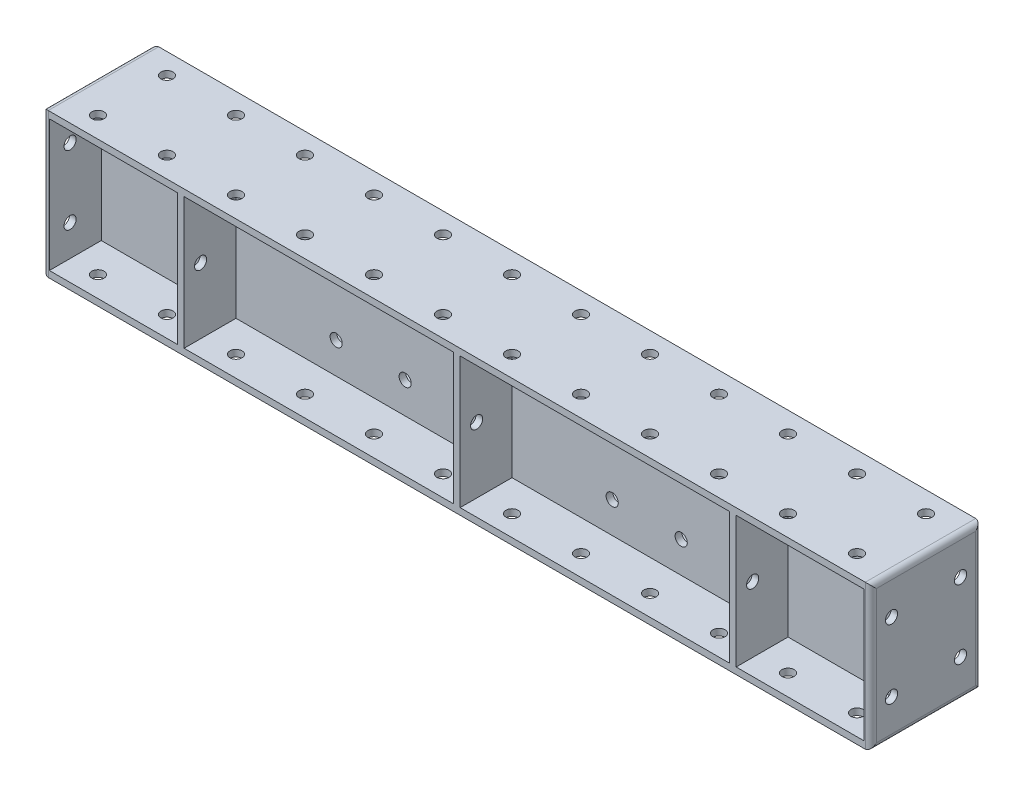
from build123d import *

# Parameters (mm, degrees)
SKETCH_1_W                        = 1500
SKETCH_1_H                        = 262
EXTRUDE_1_DEPTH                   = 200
SKETCH_5_W                        = 232
SKETCH_5_H                        = 238
SKETCH_5_W_2                      = 488
CUT_EXTRUDE_10_DEPTH              = 1536.787745751
SKETCH_7_W                        = 1500
SKETCH_7_H                        = 12
EXTRUDE_13_DEPTH                  = 260
SKETCH_8_R                        = 11
CUT_EXTRUDE_14_DEPTH              = 1536.787745751
PATTERN_LINEAR_3_COUNT            = 12
PATTERN_LINEAR_3_PITCH            = 125
PATTERN_LINEAR_3_COUNT_DIR2       = 2
PATTERN_LINEAR_3_PITCH_DIR2       = 125
SKETCH_10_R                       = 11
CUT_EXTRUDE_16_DEPTH              = 20
PATTERN_LINEAR_5_COUNT            = 2
PATTERN_LINEAR_5_PITCH            = 125
PATTERN_LINEAR_5_COUNT_DIR2       = 2
PATTERN_LINEAR_5_PITCH_DIR2       = 125
CUT_EXTRUDE_START                 = -20
SKETCH_11_R                       = 11
CUT_EXTRUDE_17_DEPTH              = 20
PATTERN_LINEAR_6_COUNT            = 2
PATTERN_LINEAR_6_PITCH            = 125
PATTERN_LINEAR_6_COUNT_DIR2       = 2
PATTERN_LINEAR_6_PITCH_DIR2       = 125
SKETCH_12_R                       = 11
CUT_EXTRUDE_18_DEPTH              = 1050
PATTERN_LINEAR_8_COUNT            = 2
PATTERN_LINEAR_8_PITCH            = 140.2426687
FILLET_1_R                        = 10
FILLET_2_R                        = 10
SKETCH_13_R                       = 11
CUT_EXTRUDE_19_DEPTH              = 1527.394444434
PATTERN_LINEAR_9_COUNT            = 2
PATTERN_LINEAR_9_PITCH            = 125
PATTERN_LINEAR_9_COUNT_DIR2       = 2
PATTERN_LINEAR_9_PITCH_DIR2       = 125
PATTERN_LINEAR_10_COUNT           = 2
PATTERN_LINEAR_10_PITCH           = 500
PATTERN_LINEAR_10_COPY_1_SKETCH_R = 11
PATTERN_LINEAR_10_COPY_1_DEPTH    = 1527.394444434
PATTERN_LINEAR_10_COPY_2_SKETCH_R = 11
PATTERN_LINEAR_10_COPY_2_DEPTH    = 1527.394444434
PATTERN_LINEAR_10_COPY_3_SKETCH_R = 11
PATTERN_LINEAR_10_COPY_3_DEPTH    = 1527.394444434


with BuildPart() as part:
    # 草图1 → 拉伸1 (new body)
    with BuildSketch(Plane.XY):
        with Locations((750, 131)):
            Rectangle(SKETCH_1_W, SKETCH_1_H)
    extrude(amount=EXTRUDE_1_DEPTH)

    # 草图5 → 拉伸10 (cut, through all)
    with BuildSketch(Plane.XY.offset(200)):
        with Locations((128, 131)):
            Rectangle(SKETCH_5_W, SKETCH_5_H)
        with Locations((500, 131)):
            Rectangle(SKETCH_5_W_2, SKETCH_5_H)
        with Locations((1000, 131)):
            Rectangle(SKETCH_5_W_2, SKETCH_5_H)
        with Locations((1372, 131)):
            Rectangle(SKETCH_5_W, SKETCH_5_H)
    extrude(amount=-CUT_EXTRUDE_10_DEPTH, mode=Mode.SUBTRACT)

    # 草图7 → 拉伸13 (add)
    with BuildSketch(Plane.XZ):
        with Locations((750, 100)):
            Rectangle(SKETCH_7_W, SKETCH_7_H)
    extrude(amount=-EXTRUDE_13_DEPTH)

    # 草图8 → 拉伸14 (cut, through all)
    with BuildSketch(Plane.XZ):
        with Locations(Location((62.5, 37.5, 0), (0, 0, 270))):
            Circle(SKETCH_8_R)
    cut_extrude_14 = extrude(amount=-CUT_EXTRUDE_14_DEPTH, mode=Mode.SUBTRACT)

    # 阵列(线性)3: Cut-Extrude 14 12 × 2
    with Locations(*[(i * PATTERN_LINEAR_3_PITCH, 0, j * PATTERN_LINEAR_3_PITCH_DIR2) for i in range(PATTERN_LINEAR_3_COUNT) for j in range(PATTERN_LINEAR_3_COUNT_DIR2) if (i, j) != (0, 0)]):
        add(cut_extrude_14, mode=Mode.SUBTRACT)

    # 草图10 → 拉伸16 (cut)
    with BuildSketch(Plane.ZY):
        with Locations((37.5, 68.5)):
            Circle(SKETCH_10_R)
    cut_extrude_16 = extrude(amount=-CUT_EXTRUDE_16_DEPTH, mode=Mode.SUBTRACT)

    # 阵列(线性)5: Cut-Extrude 16 2 × 2
    with Locations(*[(0, j * PATTERN_LINEAR_5_PITCH_DIR2, i * PATTERN_LINEAR_5_PITCH) for i in range(PATTERN_LINEAR_5_COUNT) for j in range(PATTERN_LINEAR_5_COUNT_DIR2) if (i, j) != (0, 0)]):
        add(cut_extrude_16, mode=Mode.SUBTRACT)

    # 草图11 → 拉伸17 (cut)
    with BuildSketch(Plane(origin=(1500, 0, 0), x_dir=(0, 0, -1), z_dir=(1, 0, 0)).offset(CUT_EXTRUDE_START)):
        with Locations(Location((-162.5, 68.5, 0), (0, 0, 180))):
            Circle(SKETCH_11_R)
    cut_extrude_17 = extrude(amount=CUT_EXTRUDE_17_DEPTH, mode=Mode.SUBTRACT)

    # 阵列(线性)6: Cut-Extrude 17 2 × 2
    with Locations(*[(0, j * PATTERN_LINEAR_6_PITCH_DIR2, -i * PATTERN_LINEAR_6_PITCH) for i in range(PATTERN_LINEAR_6_COUNT) for j in range(PATTERN_LINEAR_6_COUNT_DIR2) if (i, j) != (0, 0)]):
        add(cut_extrude_17, mode=Mode.SUBTRACT)

    # 草图12 → 拉伸18 (cut)
    with BuildSketch(Plane(origin=(1256, 0, 0), x_dir=(0, 0, -1), z_dir=(1, 0, 0))):
        with Locations((-170.12133435, 131)):
            Circle(SKETCH_12_R)
    cut_extrude_18 = extrude(amount=-CUT_EXTRUDE_18_DEPTH, mode=Mode.SUBTRACT)

    # 阵列(线性)8: 拉伸18 ×2
    with Locations(*[(0, 0, -i * PATTERN_LINEAR_8_PITCH) for i in range(1, PATTERN_LINEAR_8_COUNT)]):
        add(cut_extrude_18, mode=Mode.SUBTRACT)

    # 圆角1
    fillet_1_edges = [part.edges().sort_by_distance(p)[0] for p in [
        (0, 131, 200),
        (0, 131, 0),
        (0, 262, 100),
        (0, 0, 100),
    ]]
    fillet(fillet_1_edges, radius=FILLET_1_R)

    # 圆角2
    fillet_2_edges = [part.edges().sort_by_distance(p)[0] for p in [
        (1500, 131, 200),
        (1500, 131, 0),
        (1500, 262, 100),
        (1500, 0, 100),
    ]]
    fillet(fillet_2_edges, radius=FILLET_2_R)

    # 草图13 → 拉伸19 (cut, through all)
    with BuildSketch(Plane.XY.offset(106)):
        with Locations((437.5, 68.5)):
            Circle(SKETCH_13_R)
    cut_extrude_19 = extrude(amount=-CUT_EXTRUDE_19_DEPTH, mode=Mode.SUBTRACT)

    # 阵列(线性)9: Cut-Extrude 19 2 × 2
    with Locations(*[(i * PATTERN_LINEAR_9_PITCH, j * PATTERN_LINEAR_9_PITCH_DIR2, 0) for i in range(PATTERN_LINEAR_9_COUNT) for j in range(PATTERN_LINEAR_9_COUNT_DIR2) if (i, j) != (0, 0)]):
        add(cut_extrude_19, mode=Mode.SUBTRACT)

    # 阵列(线性)10: 拉伸19 ×2
    with Locations(*[(i * PATTERN_LINEAR_10_PITCH, 0, 0) for i in range(1, PATTERN_LINEAR_10_COUNT)]):
        add(cut_extrude_19, mode=Mode.SUBTRACT)

    # 阵列(线性)10 copy 1 sketch → 阵列(线性)10 copy 1 (cut, through all)
    with BuildSketch(Plane(origin=(500, 125, 106), x_dir=(1, 0, 0), z_dir=(0, 0, 1))):
        with Locations((437.5, 68.5)):
            Circle(PATTERN_LINEAR_10_COPY_1_SKETCH_R)
    extrude(amount=-PATTERN_LINEAR_10_COPY_1_DEPTH, mode=Mode.SUBTRACT)

    # 阵列(线性)10 copy 2 sketch → 阵列(线性)10 copy 2 (cut, through all)
    with BuildSketch(Plane(origin=(625, 0, 106), x_dir=(1, 0, 0), z_dir=(0, 0, 1))):
        with Locations((437.5, 68.5)):
            Circle(PATTERN_LINEAR_10_COPY_2_SKETCH_R)
    extrude(amount=-PATTERN_LINEAR_10_COPY_2_DEPTH, mode=Mode.SUBTRACT)

    # 阵列(线性)10 copy 3 sketch → 阵列(线性)10 copy 3 (cut, through all)
    with BuildSketch(Plane(origin=(625, 125, 106), x_dir=(1, 0, 0), z_dir=(0, 0, 1))):
        with Locations((437.5, 68.5)):
            Circle(PATTERN_LINEAR_10_COPY_3_SKETCH_R)
    extrude(amount=-PATTERN_LINEAR_10_COPY_3_DEPTH, mode=Mode.SUBTRACT)


solid = part.part
